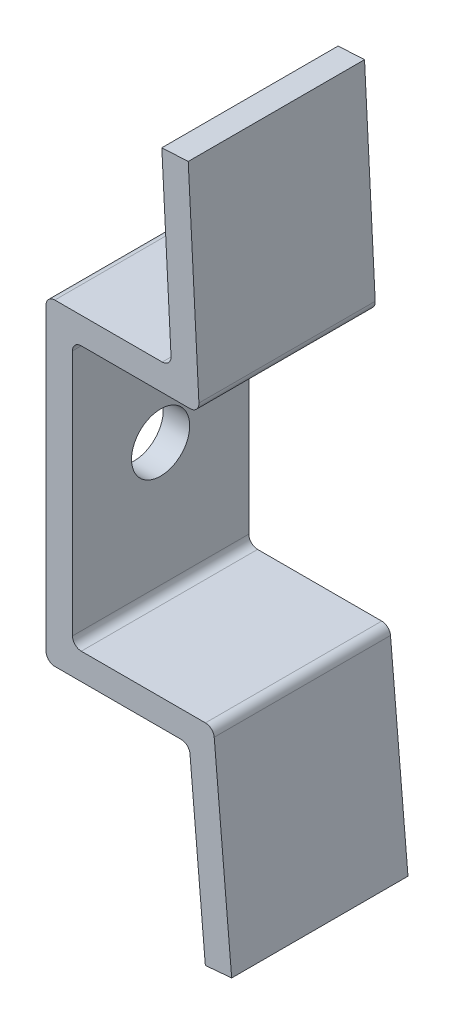
from build123d import *

# Parameters (mm, degrees)
EXTRUDE_1_DEPTH      = 10
EXTRUDE_1_DEPTH_BACK = 10
HOLE_WIZARD_M61_D    = 6.6


with BuildPart() as part:
    # Эскиз1 → Бобышка-Вытянуть1 (new, two sides: drawn at the far end of the back side and taken through both)
    with BuildSketch(Plane.XY.offset(-EXTRUDE_1_DEPTH_BACK)):
        with BuildLine():
            Line((0, 17), (0, -17))
            ThreePointArc((0, -17), (0.292893219, -17.707106781), (1, -18))
            Line((1, -18), (15.334675304, -18))
            ThreePointArc((15.334675304, -18), (16.010265512, -18.262722663), (16.330870002, -18.912844257))
            Line((16.330870002, -18.912844257), (18.073984857, -38.836738219))
            Line((18.073984857, -38.836738219), (21.062568951, -38.575270991))
            Line((21.062568951, -38.575270991), (19.079863524, -15.912844257))
            ThreePointArc((19.079863524, -15.912844257), (18.759259034, -15.262722663), (18.083668826, -15))
            Line((18.083668826, -15), (4, -15))
            ThreePointArc((4, -15), (3.292893219, -14.707106781), (3, -14))
            Line((3, -14), (3, 14))
            ThreePointArc((3, 14), (3.292893219, 14.707106781), (4, 15))
            Line((4, 15), (16.346219875, 15))
            ThreePointArc((16.346219875, 15), (17.071594246, 15.311645424), (17.344849409, 16.052335956))
            Line((17.344849409, 16.052335956), (16.132678513, 39.18193452))
            Line((16.132678513, 39.18193452), (13.136789909, 39.024926651))
            Line((13.136789909, 39.024926651), (14.183509034, 19.052335956))
            ThreePointArc((14.183509034, 19.052335956), (13.91025387, 18.311645424), (13.184879499, 18))
            Line((13.184879499, 18), (1, 18))
            ThreePointArc((1, 18), (0.292893219, 17.707106781), (0, 17))
        make_face()
    extrude(amount=EXTRUDE_1_DEPTH + EXTRUDE_1_DEPTH_BACK)

    # Отверстие с зазором M61 (through all)
    with Locations(Plane(origin=(0, 0, 0), x_dir=(0, -1, 0), z_dir=(-1, 0, 0))):
        with Locations((0, 0)):
            Hole(HOLE_WIZARD_M61_D / 2)


solid = part.part
